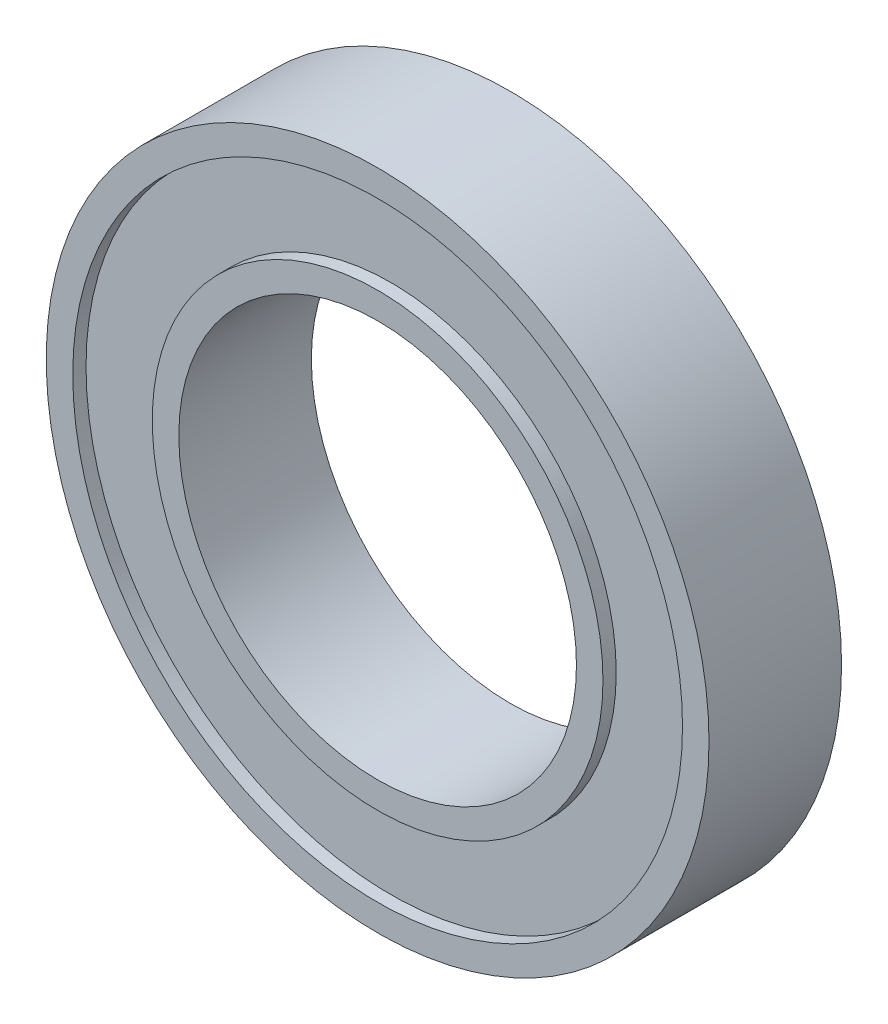
from build123d import *

# Parameters (mm, degrees)
SALIENTE_EXTRUIR1_DEPTH        = 5
SALIENTE_EXTRUIR1_DEPTH_BACK   = 5
CROQUIS1_R                     = 25
CROQUIS1_R_2                   = 23
SALIENTE_EXTRUIR1_2_DEPTH      = 5
SALIENTE_EXTRUIR1_2_DEPTH_BACK = 5
CROQUIS1_R_3                   = 17
CROQUIS1_R_4                   = 15
SALIENTE_EXTRUIR2_DEPTH        = 4
SALIENTE_EXTRUIR2_DEPTH_BACK   = 4
CROQUIS1_3_R                   = 23
CROQUIS1_3_R_2                 = 17


with BuildPart() as part:
    # Croquis1 → Saliente-Extruir1 (new, two sides: drawn at the far end of the back side and taken through both)
    with BuildSketch(Plane.XY.offset(-SALIENTE_EXTRUIR1_DEPTH_BACK)):
        Circle(CROQUIS1_R)
        Circle(CROQUIS1_R_2, mode=Mode.SUBTRACT)
    extrude(amount=SALIENTE_EXTRUIR1_DEPTH + SALIENTE_EXTRUIR1_DEPTH_BACK)



with BuildPart() as body_2:
    # Croquis1 → Saliente-Extruir1 2 (new, two sides: drawn at the far end of the back side and taken through both)
    with BuildSketch(Plane.XY.offset(-SALIENTE_EXTRUIR1_2_DEPTH_BACK)):
        Circle(CROQUIS1_R_3)
        Circle(CROQUIS1_R_4, mode=Mode.SUBTRACT)
    extrude(amount=SALIENTE_EXTRUIR1_2_DEPTH + SALIENTE_EXTRUIR1_2_DEPTH_BACK)


with BuildPart() as part_1:
    add(part.part)

    add(body_2.part)  # Saliente-Extruir2 merges body 2
    # Croquis1<3> → Saliente-Extruir2 (add, two sides: drawn at the far end of the back side and taken through both)
    with BuildSketch(Plane.XY.offset(-SALIENTE_EXTRUIR2_DEPTH_BACK)):
        Circle(CROQUIS1_3_R)
        Circle(CROQUIS1_3_R_2, mode=Mode.SUBTRACT)
    extrude(amount=SALIENTE_EXTRUIR2_DEPTH + SALIENTE_EXTRUIR2_DEPTH_BACK)


solid = part_1.part
